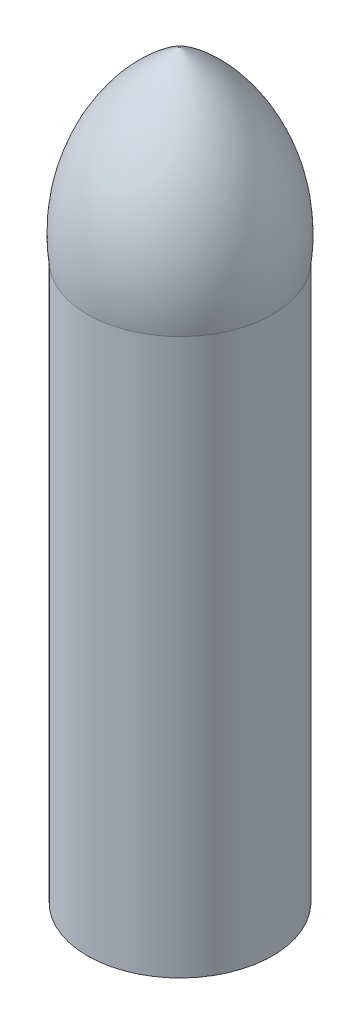
from build123d import *

# Parameters (mm, degrees)
SKETCH2_R           = 50
BOSS_EXTRUDE1_DEPTH = 300


with BuildPart() as part:
    # Sketch1 → Revolve1 (revolve)
    with BuildSketch(Plane.XY):
        with BuildLine():
            Line((0, 0), (0, 100))
            ThreePointArc((0, 100), (40.280734229, 57.640367115), (50, 0))
            Line((50, 0), (0, 0))
        make_face()
    revolve(axis=Axis((0, 0, 0), (0, 1, 0)))

    # Sketch2 → Boss-Extrude1 (add)
    with BuildSketch(Plane(origin=(0, 0, 0), x_dir=(-1, 0, 0), z_dir=(0, -1, 0))):
        with Locations(Location((0, 0, 0), (0, 0, 90))):
            Circle(SKETCH2_R)
    extrude(amount=BOSS_EXTRUDE1_DEPTH)


solid = part.part
